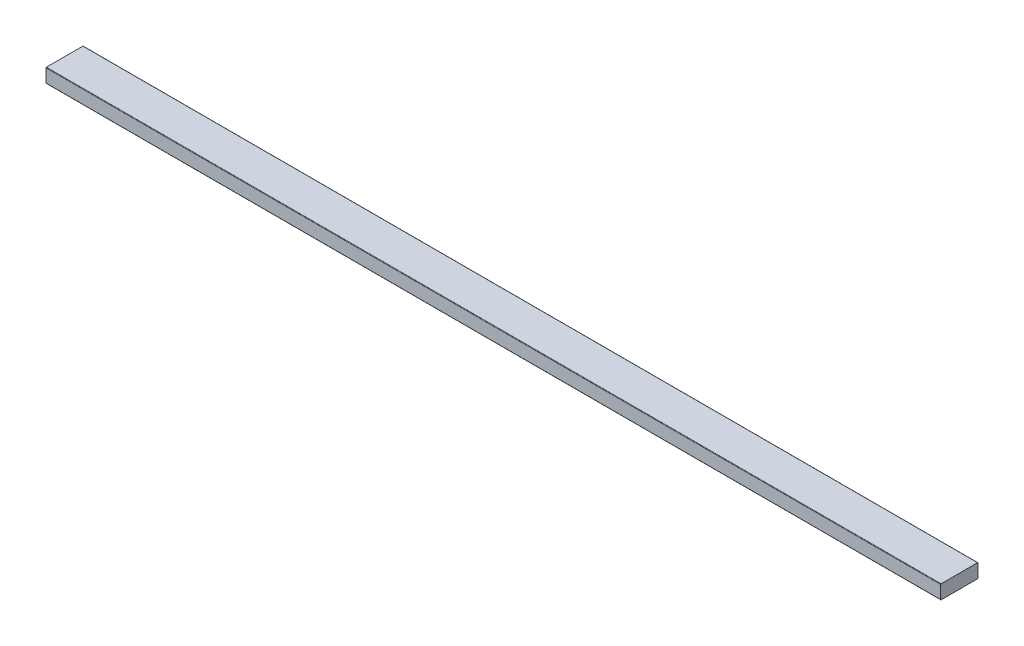
from build123d import *

# Parameters (mm, degrees)
BOSS_EXTRUDE1_DEPTH      = 4.7625
BOSS_EXTRUDE1_DEPTH_BACK = 4.7625
SKETCH3_W                = 609.6
SKETCH3_H                = 25.4
FILLET1_R                = 0.314325


with BuildPart() as part:
    # Sketch3 → Boss-Extrude1 (new, two sides: drawn at the far end of the back side and taken through both)
    with BuildSketch(Plane(origin=(0, 0, 0), x_dir=(1, 0, 0), z_dir=(0, 1, 0)).offset(-BOSS_EXTRUDE1_DEPTH_BACK)):
        Rectangle(SKETCH3_W, SKETCH3_H)
    extrude(amount=BOSS_EXTRUDE1_DEPTH + BOSS_EXTRUDE1_DEPTH_BACK)

    # Fillet1
    fillet1_edges = [part.edges().sort_by_distance(p)[0] for p in [
        (0, 4.7625, 12.7),
        (0, -4.7625, -12.7),
        (0, 4.7625, -12.7),
        (0, -4.7625, 12.7),
    ]]
    fillet(fillet1_edges, radius=FILLET1_R)


solid = part.part
